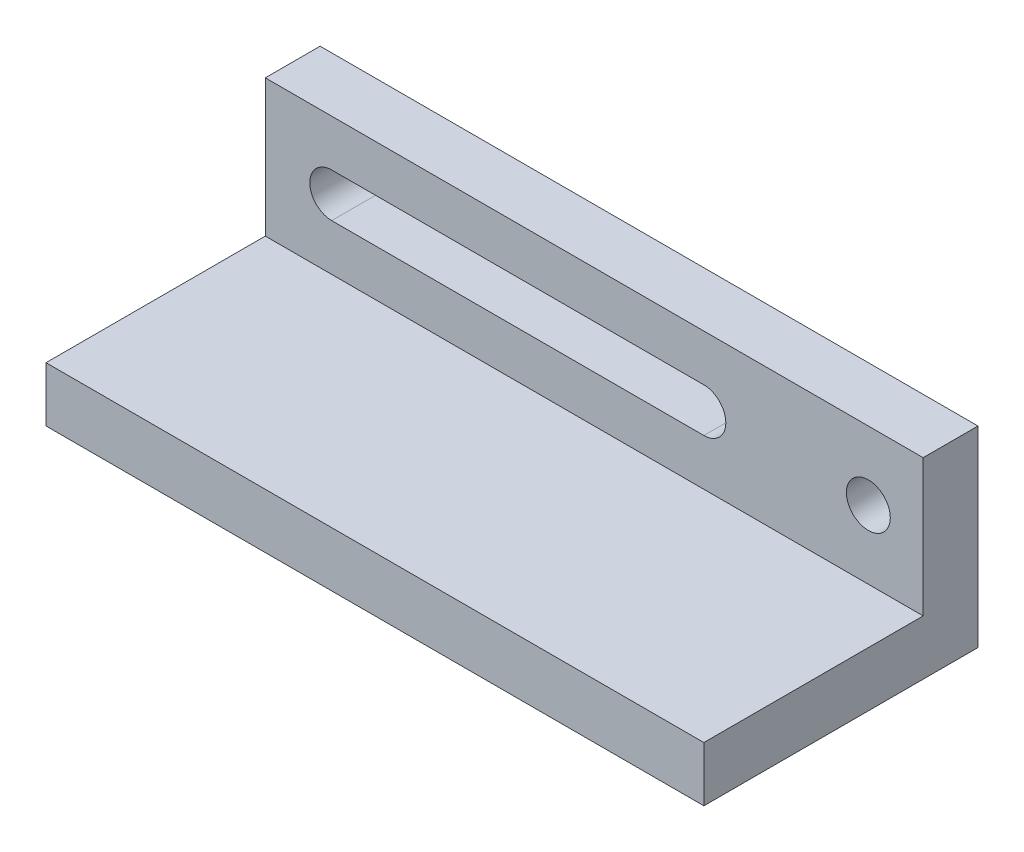
from build123d import *

# Parameters (mm, degrees)
SKETCH1_W           = 120
SKETCH1_H           = 25
SKETCH1_R           = 4
BOSS_EXTRUDE1_DEPTH = 10
SKETCH2_W           = 120
SKETCH2_H           = 10
BOSS_EXTRUDE2_DEPTH = 50


with BuildPart() as part:
    # Sketch1 → Boss-Extrude1 (new body)
    with BuildSketch(Plane.XY):
        Rectangle(SKETCH1_W, SKETCH1_H)
        with Locations((50, 0)):
            Circle(SKETCH1_R, mode=Mode.SUBTRACT)
        with BuildLine():
            Line((-47.89, 4), (20, 4))
            ThreePointArc((20, 4), (24, 0), (20, -4))
            Line((20, -4), (-47.89, -4))
            ThreePointArc((-47.89, -4), (-51.89, 0), (-47.89, 4))
        make_face(mode=Mode.SUBTRACT)
    extrude(amount=BOSS_EXTRUDE1_DEPTH)

    # Sketch2 → Boss-Extrude2 (add)
    with BuildSketch(Plane(origin=(0, 0, 0), x_dir=(-1, 0, 0), z_dir=(0, 0, -1))):
        with Locations((0, -17.5)):
            Rectangle(SKETCH2_W, SKETCH2_H)
    extrude(amount=-BOSS_EXTRUDE2_DEPTH)


solid = part.part
